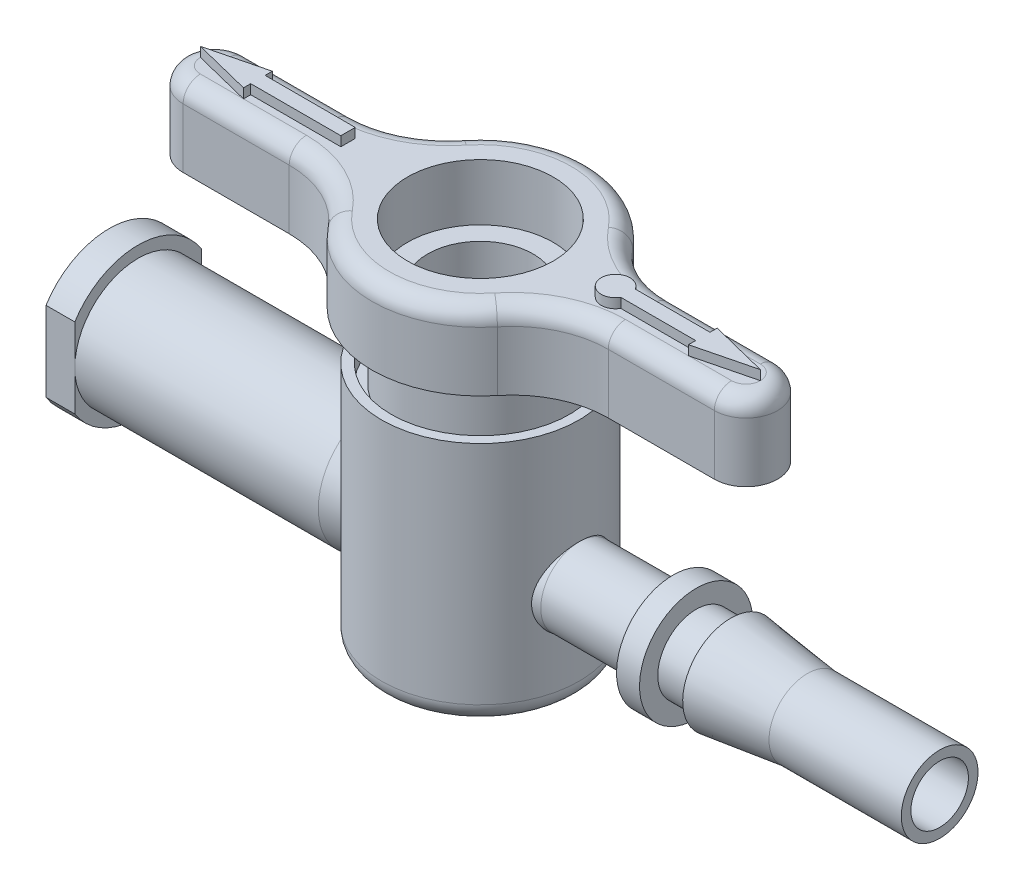
from build123d import *

# Parameters (mm, degrees)
SKETCH1_R               = 5.15
BOSS_EXTRUDE1_DEPTH     = 12.8
FILLET1_R               = 1
SKETCH3_R               = 4.15
CUT_EXTRUDE1_DEPTH      = 11.8
SKETCH4_R               = 1.5
CUT_EXTRUDE2_DEPTH      = 46.445049275
SKETCH5_R               = 4.65
SKETCH5_R_2             = 4.15
CUT_EXTRUDE3_DEPTH      = 3
CUT_EXTRUDE4_START      = -1
SKETCH6_R               = 5.05
SKETCH6_R_2             = 4.65
CUT_EXTRUDE4_DEPTH      = 0.5
CUT_EXTRUDE7_DEPTH      = 28.639916939
CUT_EXTRUDE7_DEPTH_BACK = 28.639916939
SKETCH11_W              = 1.5
SKETCH11_H              = 0.6
BOSS_EXTRUDE2_START     = 2.5
SKETCH8_R               = 3.8
BOSS_EXTRUDE2_DEPTH     = 4
FILLET2_R               = 0.9
SKETCH9_R               = 1
CUT_EXTRUDE5_DEPTH      = 48.742041262
BOSS_EXTRUDE3_DEPTH     = 0.5


with BuildPart() as part:
    # Sketch1 → Boss-Extrude1 (new body)
    with BuildSketch(Plane(origin=(0, 0, 0), x_dir=(1, 0, 0), z_dir=(0, 1, 0))):
        with Locations(Location((0, 0, 0), (0, 0, 270))):
            Circle(SKETCH1_R)
    extrude(amount=BOSS_EXTRUDE1_DEPTH)

    # Fillet1
    fillet1_edges = [part.edges().sort_by_distance(p)[0] for p in [
        (0, 0, -5.15),
    ]]
    fillet(fillet1_edges, radius=FILLET1_R)

    # Sketch2 → Revolve1 (revolve)
    with BuildSketch(Plane.XY):
        Polygon((-19.35, 3.175), (-19.35, 1.4), (-17.85, 1.4), (-17.85, 2), (-5.15, 2), (5.15, 3.3), (10.05, 3.3), (10.05, 2.35), (11.25, 2.35), (11.25, 3.3), (13.05, 3.3), (13.05, 2.8), (17.05, 3.3), (23.95, 3.3), (23.95, 3.8), (-5.15, 3.8), (-10.35, 3.175), align=None)
    revolve(axis=Axis((-19.35, 5.3, 0), (1, 0, 0)))

    # Sketch3 → Cut-Extrude1 (cut)
    with BuildSketch(Plane(origin=(0, 12.8, 0), x_dir=(1, 0, 0), z_dir=(0, 1, 0))):
        with Locations(Location((0, 0, 0), (0, 0, 270))):
            Circle(SKETCH3_R)
    extrude(amount=-CUT_EXTRUDE1_DEPTH, mode=Mode.SUBTRACT)

    # Sketch4 → Cut-Extrude2 (cut, through all)
    with BuildSketch(Plane(origin=(23.95, 0, 0), x_dir=(0, 0, -1), z_dir=(1, 0, 0))):
        with Locations(Location((0, 5.3, 0), (0, 0, 270))):
            Circle(SKETCH4_R)
    extrude(amount=-CUT_EXTRUDE2_DEPTH, mode=Mode.SUBTRACT)

    # Sketch5 → Cut-Extrude3 (cut)
    with BuildSketch(Plane(origin=(0, 12.8, 0), x_dir=(1, 0, 0), z_dir=(0, 1, 0))):
        with Locations(Location((0, 0, 0), (0, 0, 270))):
            Circle(SKETCH5_R)
        with Locations(Location((0, 0, 0), (0, 0, 270))):
            Circle(SKETCH5_R_2, mode=Mode.SUBTRACT)
    extrude(amount=-CUT_EXTRUDE3_DEPTH, mode=Mode.SUBTRACT)

    # Sketch6 → Cut-Extrude4 (cut)
    with BuildSketch(Plane(origin=(0, 12.8, 0), x_dir=(1, 0, 0), z_dir=(0, 1, 0)).offset(CUT_EXTRUDE4_START)):
        with Locations(Location((0, 0, 0), (0, 0, 270))):
            Circle(SKETCH6_R)
        with Locations(Location((0, 0, 0), (0, 0, 270))):
            Circle(SKETCH6_R_2, mode=Mode.SUBTRACT)
    extrude(amount=-CUT_EXTRUDE4_DEPTH, mode=Mode.SUBTRACT)

    # Sketch11 → Cut-Extrude7 (cut, two sides: drawn at the far end of the back side and taken through both)
    with BuildSketch(Plane(origin=(0, 0, 0), x_dir=(1, 0, 0), z_dir=(0, 1, 0)).offset(-CUT_EXTRUDE7_DEPTH_BACK)):
        with Locations((-18.6, 3.6)):
            Rectangle(SKETCH11_W, SKETCH11_H)
        with Locations((-18.6, -3.6)):
            Rectangle(SKETCH11_W, SKETCH11_H)
    extrude(amount=CUT_EXTRUDE7_DEPTH + CUT_EXTRUDE7_DEPTH_BACK, mode=Mode.SUBTRACT)


with BuildPart() as body_2:
    # Sketch7 → Revolve2 (revolve)
    with BuildSketch(Plane.XY, mode=Mode.PRIVATE) as revolve2_sk:
        Polygon((2.15, 1.2), (4.15, 1.2), (4.15, 9.8), (4.65, 9.8), (4.65, 11.3), (5.05, 11.3), (5.05, 11.8), (4.15, 11.8), (4.15, 16.35), (2.75, 16.35), (2.75, 7.35), (0, 7.35), (0, 2.2), (2.15, 2.2), align=None)
    revolve(revolve2_sk.sketch.rotate(Axis((0, 16.35, 0), (0, -1, 0)), 180), axis=Axis((0, 16.35, 0), (0, -1, 0)))

    # Sketch8 → Boss-Extrude2 (add)
    with BuildSketch(Plane(origin=(0, 12.8, 0), x_dir=(1, 0, 0), z_dir=(0, 1, 0)).offset(BOSS_EXTRUDE2_START)):
        with BuildLine():
            Line((-8.318653737, 1.65), (-13.85, 1.65))
            ThreePointArc((-13.85, 1.65), (-15.5, 0), (-13.85, -1.65))
            Line((-13.85, -1.65), (-8.318653737, -1.65))
            ThreePointArc((-8.318653737, -1.65), (-6.151896787, -2.1438748), (-4.413182499, -3.527934272))
            ThreePointArc((-4.413182499, -3.527934272), (0, -5.65), (4.413182499, -3.527934272))
            ThreePointArc((4.413182499, -3.527934272), (6.151896787, -2.1438748), (8.318653737, -1.65))
            Line((8.318653737, -1.65), (13.85, -1.65))
            ThreePointArc((13.85, -1.65), (15.5, 0), (13.85, 1.65))
            Line((13.85, 1.65), (8.318653737, 1.65))
            ThreePointArc((8.318653737, 1.65), (6.151896787, 2.1438748), (4.413182499, 3.527934272))
            ThreePointArc((4.413182499, 3.527934272), (0, 5.65), (-4.413182499, 3.527934272))
            ThreePointArc((-4.413182499, 3.527934272), (-6.151896787, 2.1438748), (-8.318653737, 1.65))
        make_face()
        Circle(SKETCH8_R, mode=Mode.SUBTRACT)
    extrude(amount=BOSS_EXTRUDE2_DEPTH)

    # Fillet2
    fillet2_edges = [body_2.edges().sort_by_distance(p)[0] for p in [
        (-6.151896787, 19.3, 2.1438748),
        (0, 19.3, 5.65),
        (6.151896787, 19.3, 2.1438748),
        (11.084326869, 19.3, 1.65),
        (15.5, 19.3, 0),
        (11.084326869, 19.3, -1.65),
        (6.151896787, 19.3, -2.1438748),
        (0, 19.3, -5.65),
        (-6.151896787, 19.3, -2.1438748),
        (-11.084326869, 19.3, -1.65),
        (-15.5, 19.3, 0),
        (-11.084326869, 19.3, 1.65),
    ]]
    fillet(fillet2_edges, radius=FILLET2_R)

    # Sketch9 → Cut-Extrude5 (cut, through all)
    with BuildSketch(Plane(origin=(23.95, 0, 0), x_dir=(0, 0, -1), z_dir=(1, 0, 0))):
        with Locations(Location((0, 5.3, 0), (0, 0, 90))):
            Circle(SKETCH9_R)
    extrude(amount=-CUT_EXTRUDE5_DEPTH, mode=Mode.SUBTRACT)

    # Sketch10 → Boss-Extrude3 (add)
    with BuildSketch(Plane(origin=(0, 19.3, 0), x_dir=(1, 0, 0), z_dir=(0, 1, 0))):
        Polygon((-6.9, 0.375), (-11.6, 0.375), (-11.6, 0.75), (-14.6, 0), (-11.6, -0.75), (-11.6, -0.375), (-6.9, -0.375), align=None)
        with BuildLine():
            Line((11.6, -0.375), (7.699519053, -0.375))
            ThreePointArc((7.699519053, -0.375), (6.3, 0), (7.699519053, 0.375))
            Line((7.699519053, 0.375), (11.6, 0.375))
            Line((11.6, 0.375), (11.6, 0.75))
            Line((11.6, 0.75), (14.6, 0))
            Line((14.6, 0), (11.6, -0.75))
            Line((11.6, -0.75), (11.6, -0.375))
        make_face()
    extrude(amount=BOSS_EXTRUDE3_DEPTH)


solid = Compound([part.part, body_2.part])
